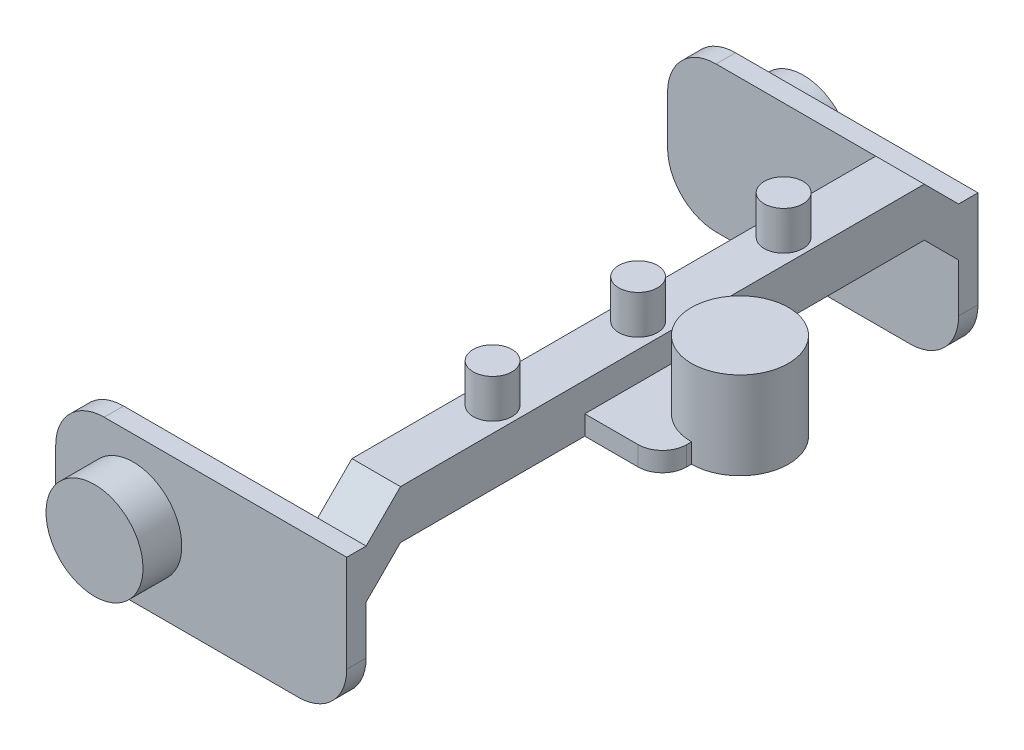
from build123d import *
from build123d.topology import SkipClean

# Parameters (mm, degrees)
SKETCH1_W            = 5
SKETCH1_H            = 54
BOSS_EXTRUDE1_DEPTH  = 5
SKETCH3_W            = 16
SKETCH3_H            = 16
BOSS_EXTRUDE2_DEPTH  = 2
SKETCH4_R            = 5
BOSS_EXTRUDE3_DEPTH  = 7
SKETCH6_W            = 5
SKETCH6_H            = 5
BOSS_EXTRUDE5_DEPTH  = 5
SKETCH7_R            = 2
BOSS_EXTRUDE6_DEPTH  = 4
SKETCH10_W           = 30
SKETCH10_H           = 15
BOSS_EXTRUDE9_DEPTH  = 2
SKETCH11_R           = 5
BOSS_EXTRUDE10_DEPTH = 4
FILLET1_R            = 5
FILLET1_OF_MIRROR2_R = 5
CUT_EXTRUDE1_REACH   = 51.761
FILLET2_R            = 2.5


with BuildPart() as part:
    # Sketch1 → Boss-Extrude1 (new body)
    with BuildSketch(Plane(origin=(0, 0, 0), x_dir=(1, 0, 0), z_dir=(0, 1, 0))):
        with Locations((-2.5, 0)):
            Rectangle(SKETCH1_W, SKETCH1_H)
    extrude(amount=BOSS_EXTRUDE1_DEPTH)

    # Sketch3 → Boss-Extrude2 (add)
    with BuildSketch(Plane(origin=(0, 0, 0), x_dir=(1, 0, 0), z_dir=(0, 1, 0))):
        with Locations((8, 0)):
            Rectangle(SKETCH3_W, SKETCH3_H)
    extrude(amount=BOSS_EXTRUDE2_DEPTH)

    # Sketch4 → Boss-Extrude3 (add)
    with BuildSketch(Plane(origin=(0, 2, 0), x_dir=(1, 0, 0), z_dir=(0, 1, 0))):
        with Locations(Location((8, 0, 0), (0, 0, 90))):
            Circle(SKETCH4_R)
    extrude(amount=BOSS_EXTRUDE3_DEPTH)

    # Sketch6 → Boss-Extrude5 (add, along a direction that is not the sketch's normal)
    with BuildSketch(Plane.XY.offset(27)):
        with Locations((-2.5, 2.5)):
            Rectangle(SKETCH6_W, SKETCH6_H)
    boss_extrude5 = extrude(amount=BOSS_EXTRUDE5_DEPTH, dir=(0, -0.7071067811865479, 0.7071067811865472))

    # Mirror1: Boss-Extrude5 across plane
    add(boss_extrude5.mirror(Plane.XY))

    # Sketch7 → Boss-Extrude6 (add)
    with BuildSketch(Plane(origin=(0, 5, 0), x_dir=(1, 0, 0), z_dir=(0, 1, 0))):
        with Locations(Location((-2.5, 0, 0), (0, 0, 90))):
            Circle(SKETCH7_R)
        with Locations(Location((-2.5, 15, 0), (0, 0, 90))):
            Circle(SKETCH7_R)
        with Locations(Location((-2.5, -15, 0), (0, 0, 90))):
            Circle(SKETCH7_R)
    extrude(amount=BOSS_EXTRUDE6_DEPTH)

    # Sketch10 → Boss-Extrude9 (add)
    with BuildSketch(Plane.XY.offset(30.535533906)):
        with Locations((-15, -6.035533906)):
            Rectangle(SKETCH10_W, SKETCH10_H)
    boss_extrude9 = extrude(amount=BOSS_EXTRUDE9_DEPTH)

    # Sketch11 → Boss-Extrude10 (add)
    with BuildSketch(Plane.XY.offset(32.535533906)):
        with Locations(Location((-22, -6.035533906, 0), (0, 0, 180))):
            Circle(SKETCH11_R)
    boss_extrude10 = extrude(amount=BOSS_EXTRUDE10_DEPTH)

    # Fillet1
    fillet1_edges = [part.edges().sort_by_distance(p)[0] for p in [
        (-30, 1.464466094, 31.535533906),
        (-30, -13.535533906, 31.535533906),
        (0, -13.535533906, 31.535533906),
    ]]
    fillet(fillet1_edges, radius=FILLET1_R)

    # Mirror2: Boss-Extrude9, Boss-Extrude10 across plane
    add(boss_extrude9.mirror(Plane.XY))
    add(boss_extrude10.mirror(Plane.XY))

    # Fillet1 of Mirror2
    fillet1_of_mirror2_edges = [part.edges().sort_by_distance(p)[0] for p in [
        (-30, 1.464466094, -31.535533906),
        (-30, -13.535533906, -31.535533906),
        (0, -13.535533906, -31.535533906),
    ]]
    fillet(fillet1_of_mirror2_edges, radius=FILLET1_OF_MIRROR2_R)

    # Sketch12 → Cut-Extrude1 (cut, up to next)
    with BuildSketch(Plane(origin=(0, 2, 0), x_dir=(1, 0, 0), z_dir=(0, 1, 0)), mode=Mode.PRIVATE) as cut_extrude1_sk1:
        with BuildLine():
            Line((8, 5), (8, 8))
            Line((8, 8), (16, 8))
            Line((16, 8), (16, -8))
            Line((16, -8), (8, -8))
            Line((8, -8), (8, -5))
            ThreePointArc((8, -5), (13, 0), (8, 5))
        make_face()
    cut_extrude1_tool1 = extrude(cut_extrude1_sk1.sketch, amount=-CUT_EXTRUDE1_REACH, mode=Mode.PRIVATE) & part.part
    add(cut_extrude1_tool1.solids().sort_by_distance((8.178885, 2, -6.5))[0], mode=Mode.SUBTRACT)

    # Fillet2
    fillet2_edges = [part.edges().sort_by_distance(p)[0] for p in [
        (8, 1, -8),
        (8, 1, 8),
    ]]
    fillet(fillet2_edges, radius=FILLET2_R)


solid = part.part
